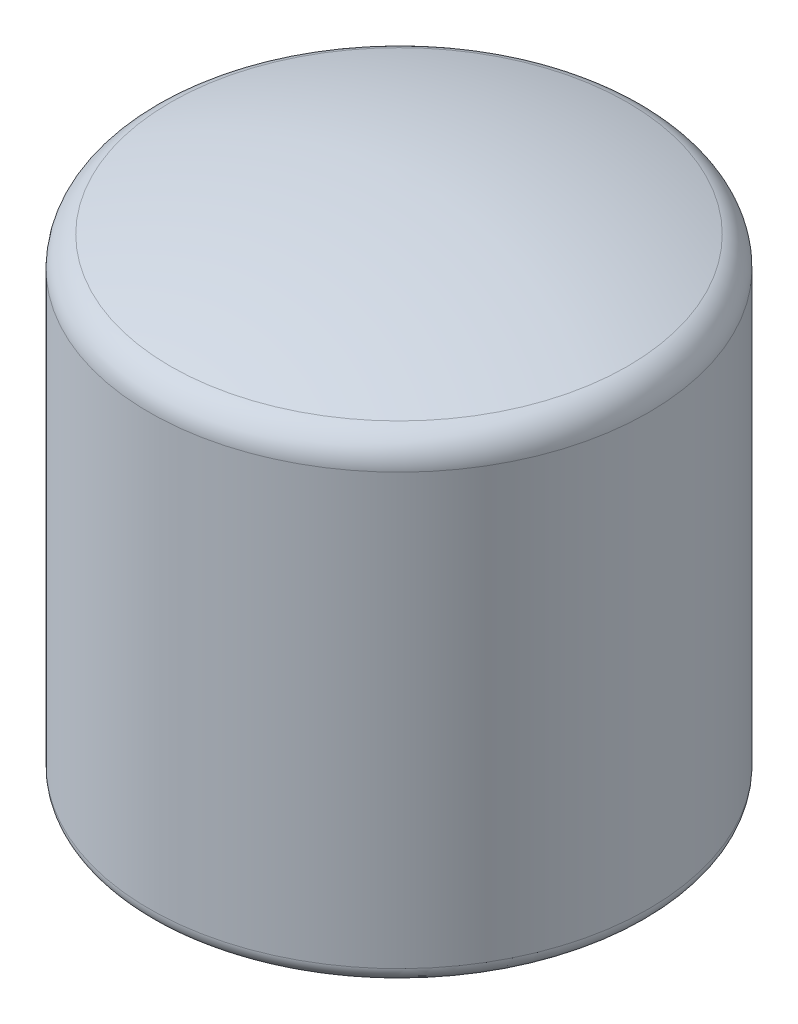
from build123d import *

# Parameters (mm, degrees)
CONG_1_R = 2
CONG_2_R = 1


with BuildPart() as part:
    # Esquisse1 → Révolution1 (revolve)
    with BuildSketch(Plane.XY, mode=Mode.PRIVATE) as r_volution1_sk:
        with BuildLine():
            Line((0, 31.9), (0, 28.9))
            Line((0, 28.9), (-12.5, 28.9))
            Line((-12.5, 28.9), (-12.5, 12.6))
            Line((-12.5, 12.6), (-12.5, 9.3))
            Line((-12.5, 9.3), (-9, 9.3))
            Line((-9, 9.3), (-9, 6.3))
            Line((-9, 6.3), (-12.5, 6.3))
            Line((-12.5, 6.3), (-12.5, 3))
            Line((-12.5, 3), (-9, 3))
            Line((-9, 3), (-9, 0))
            Line((-9, 0), (-12.5, 0))
            Line((-12.5, 0), (-16, 0))
            Line((-16, 0), (-16, 29.95948169))
            ThreePointArc((-16, 29.95948169), (-8.133981927, 32.158765663), (0, 32.9))
            Line((0, 32.9), (0, 31.9))
        make_face()
    revolve(r_volution1_sk.sketch.rotate(Axis((0, 0, 0), (0, 1, 0)), 180), axis=Axis((0, 0, 0), (0, 1, 0)))

    # Congé1
    cong_1_edges = [part.edges().sort_by_distance(p)[0] for p in [
        (-16, 29.95948169, 0),
    ]]
    fillet(cong_1_edges, radius=CONG_1_R)

    # Congé2
    cong_2_edges = [part.edges().sort_by_distance(p)[0] for p in [
        (-16, 0, 0),
    ]]
    fillet(cong_2_edges, radius=CONG_2_R)


solid = part.part
